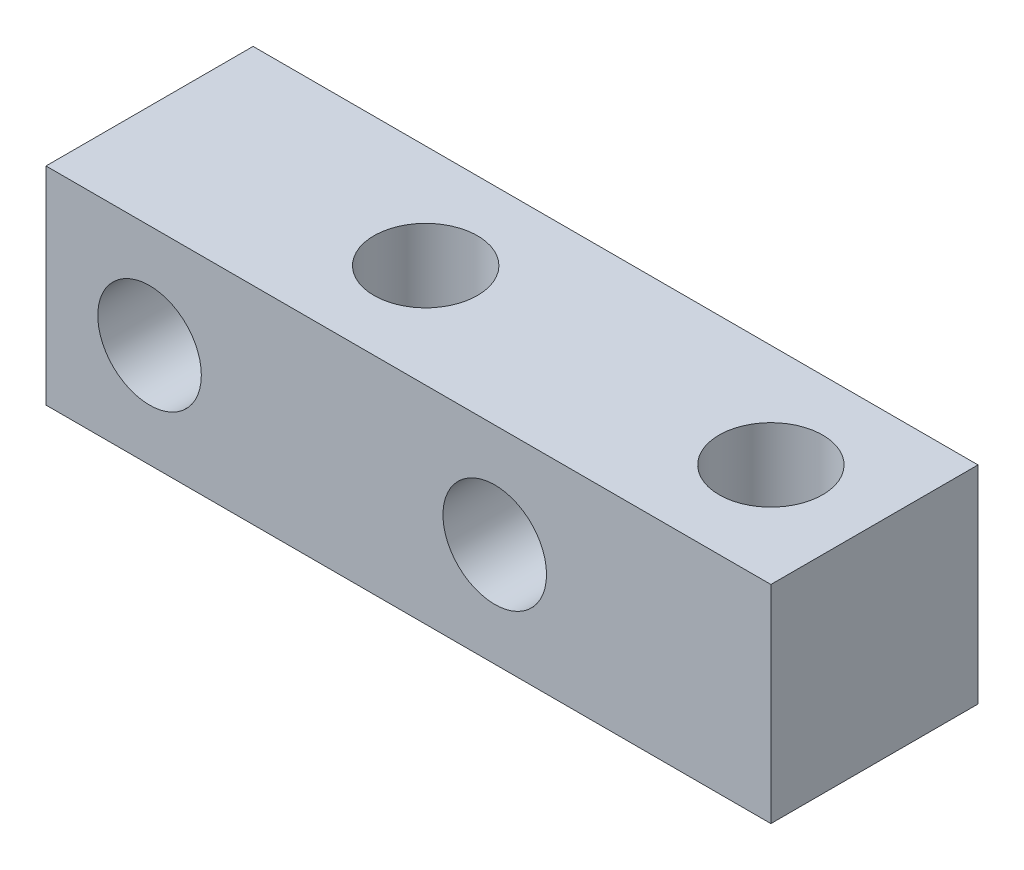
from build123d import *

# Parameters (mm, degrees)
SKETCH_1_W          = 21
SKETCH_1_H          = 6
EXTRUDE_1_DEPTH     = 6
SKETCH_2_R          = 1.5
CUT_EXTRUDE_1_DEPTH = 6
SKETCH_3_R          = 1.5
CUT_EXTRUDE_2_DEPTH = 6


with BuildPart() as part:
    # 草图1 → 凸台-拉伸1 (new body)
    with BuildSketch(Plane.XY):
        Rectangle(SKETCH_1_W, SKETCH_1_H)
    extrude(amount=EXTRUDE_1_DEPTH)

    # 草图2 → 切除-拉伸1 (cut)
    with BuildSketch(Plane.XY.offset(6)):
        with Locations((-7.5, 0)):
            Circle(SKETCH_2_R)
        with Locations((2.5, 0)):
            Circle(SKETCH_2_R)
    extrude(amount=-CUT_EXTRUDE_1_DEPTH, mode=Mode.SUBTRACT)

    # 草图3 → 切除-拉伸2 (cut)
    with BuildSketch(Plane(origin=(0, 3, 0), x_dir=(1, 0, 0), z_dir=(0, 1, 0))):
        with Locations(Location((7.5, -3, 0), (0, 0, 270))):
            Circle(SKETCH_3_R)
        with Locations(Location((-2.5, -3, 0), (0, 0, 270))):
            Circle(SKETCH_3_R)
    extrude(amount=-CUT_EXTRUDE_2_DEPTH, mode=Mode.SUBTRACT)


solid = part.part
